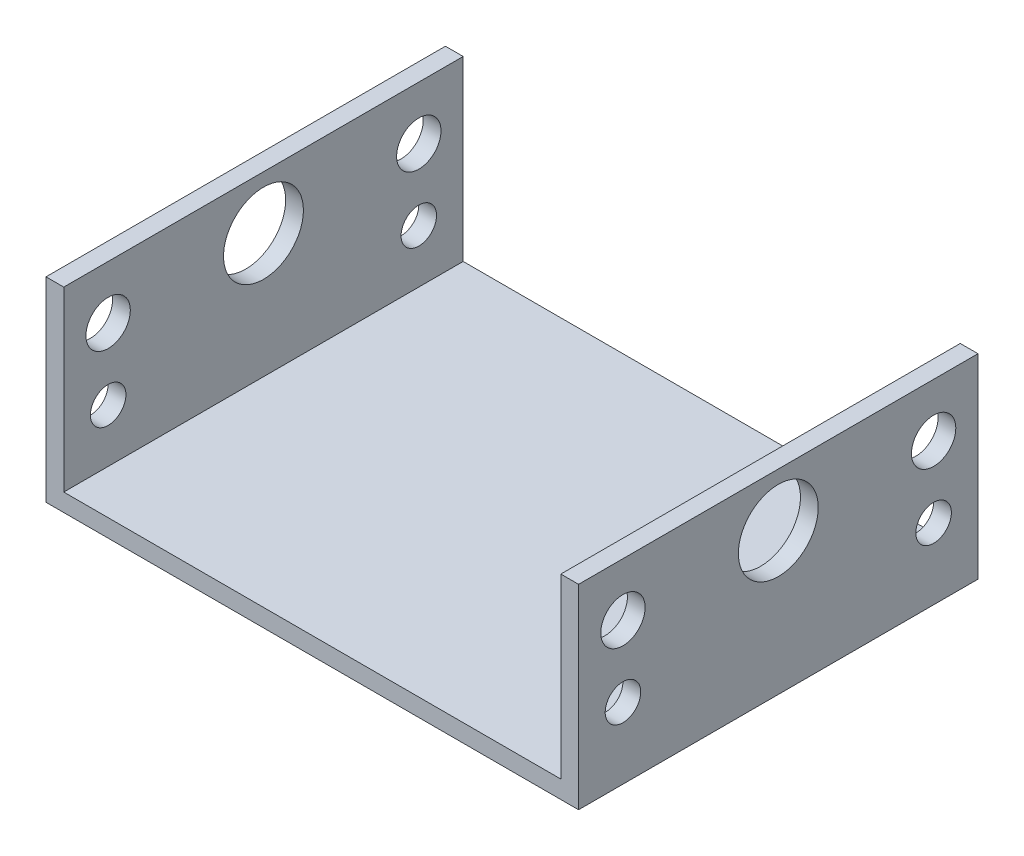
from build123d import *

# Parameters (mm, degrees)
SKETCH1_W               = 60
SKETCH1_H               = 45
BOSS_EXTRUDE1_DEPTH     = 2
SKETCH2_W               = 2
SKETCH2_H               = 45
BOSS_EXTRUDE2_DEPTH     = 20
CUT_EXTRUDE1_DEPTH      = 68.75138375
CUT_EXTRUDE1_DEPTH_BACK = 68.75138375
SKETCH3_R               = 2
SKETCH3_R_2             = 4.5
SKETCH3_R_3             = 2.5


with BuildPart() as part:
    # Sketch1 → Boss-Extrude1 (new body)
    with BuildSketch(Plane(origin=(0, 0, 0), x_dir=(1, 0, 0), z_dir=(0, 1, 0))):
        Rectangle(SKETCH1_W, SKETCH1_H)
    extrude(amount=BOSS_EXTRUDE1_DEPTH)

    # Sketch2 → Boss-Extrude2 (add)
    with BuildSketch(Plane(origin=(0, 2, 0), x_dir=(1, 0, 0), z_dir=(0, 1, 0))):
        with Locations((-29, 0)):
            Rectangle(SKETCH2_W, SKETCH2_H)
        with Locations((29, 0)):
            Rectangle(SKETCH2_W, SKETCH2_H)
    extrude(amount=BOSS_EXTRUDE2_DEPTH)

    # Sketch3 → Cut-Extrude1 (cut, two sides: drawn at the far end of the back side and taken through both)
    with BuildSketch(Plane(origin=(30, 0, 0), x_dir=(0, 0, -1), z_dir=(1, 0, 0)).offset(-CUT_EXTRUDE1_DEPTH_BACK)):
        with Locations((-17.5, 8)):
            Circle(SKETCH3_R)
        with Locations((17.5, 8)):
            Circle(SKETCH3_R)
        with Locations((0, 16)):
            Circle(SKETCH3_R_2)
        with Locations((17.5, 16)):
            Circle(SKETCH3_R_3)
        with Locations((-17.5, 16)):
            Circle(SKETCH3_R_3)
    extrude(amount=CUT_EXTRUDE1_DEPTH + CUT_EXTRUDE1_DEPTH_BACK, mode=Mode.SUBTRACT)


solid = part.part
